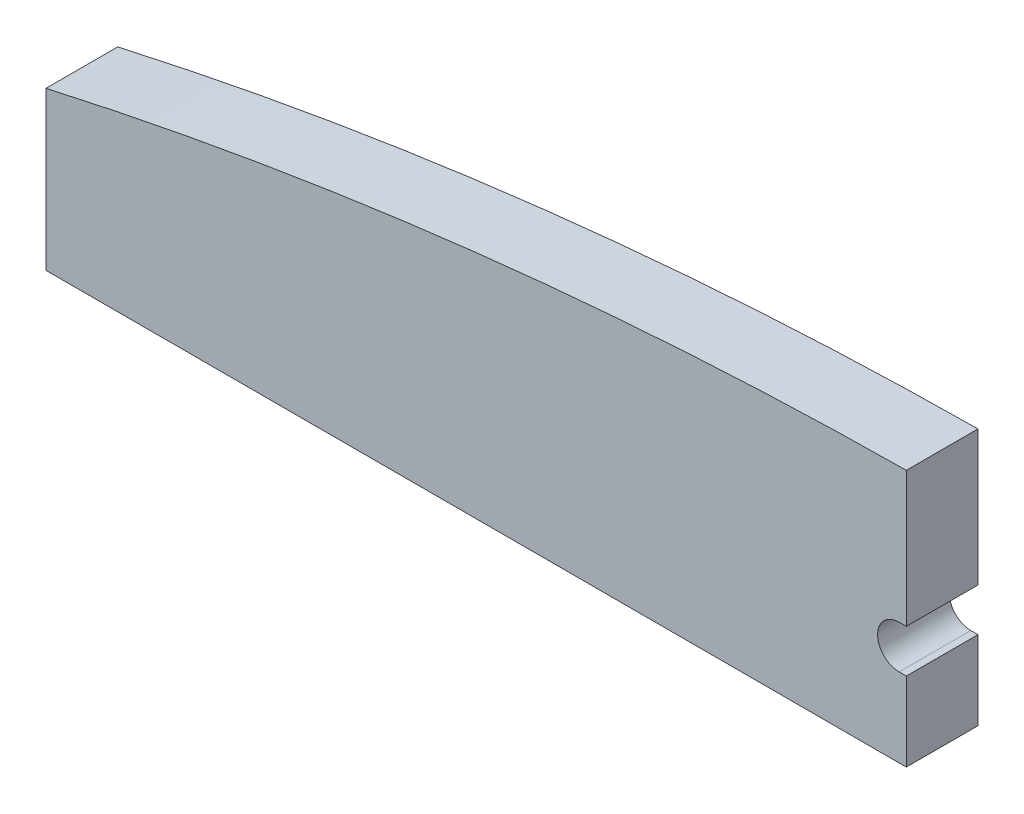
from build123d import *

# Parameters (mm, degrees)
EXTRUDE_1_DEPTH = 5


with BuildPart() as part:
    # Эскиз1 → Бобышка-Вытянуть1 (new body)
    with BuildSketch(Plane.XY):
        with BuildLine():
            ThreePointArc((-3, 12.562492976), (-4.5, 11.062492976), (-3, 9.562492976))
            Line((-3, 9.562492976), (-2.5, 9.562492976))
            Line((-2.5, 9.562492976), (-2.5, 4.062492976))
            Line((-2.5, 4.062492976), (-6, 4.062492976))
            Line((-6, 4.062492976), (-62.5, 4.062492976))
            Line((-62.5, 4.062492976), (-62.5, 15.062492976))
            ThreePointArc((-62.5, 15.062492976), (-32.684005961, 20.119684505), (-2.5, 21.989034877))
            Line((-2.5, 21.989034877), (-2.5, 12.562492976))
            Line((-2.5, 12.562492976), (-3, 12.562492976))
        make_face()
    extrude(amount=EXTRUDE_1_DEPTH)


solid = part.part
